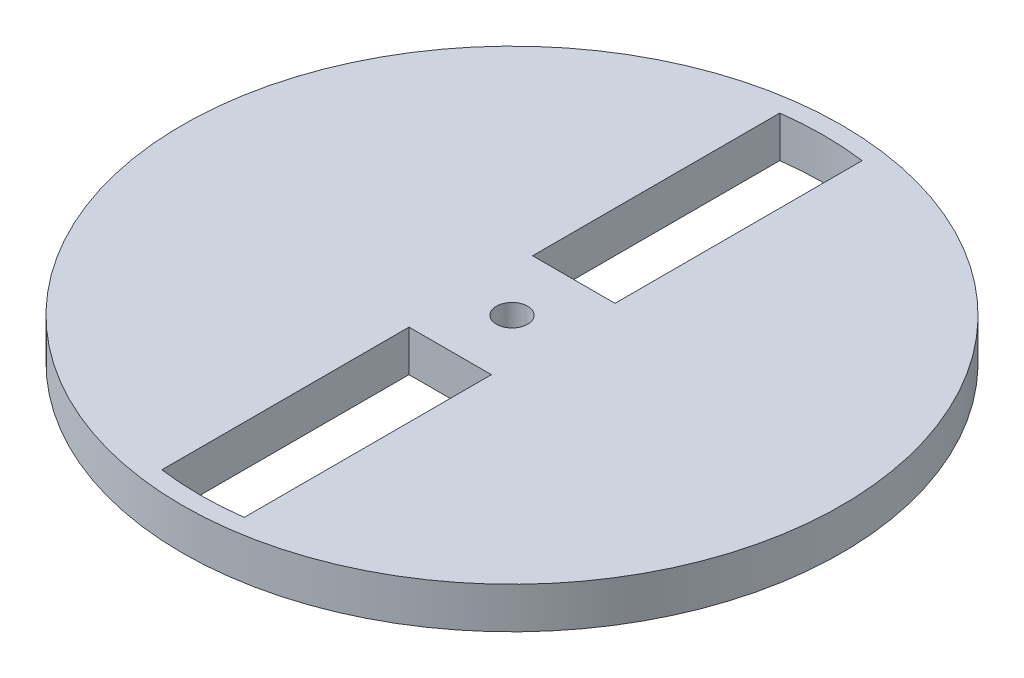
from build123d import *

# Parameters (mm, degrees)
SKETCH1_R           = 20
SKETCH1_R_2         = 0.95
BOSS_EXTRUDE1_DEPTH = 2.5


with BuildPart() as part:
    # Sketch1 → Boss-Extrude1 (new body)
    with BuildSketch(Plane(origin=(0, 0, 0), x_dir=(1, 0, 0), z_dir=(0, 1, 0))):
        with Locations(Location((0, 0, 0), (0, 0, 270))):
            Circle(SKETCH1_R)
        with Locations(Location((0, 0, 0), (0, 0, 270))):
            Circle(SKETCH1_R_2, mode=Mode.SUBTRACT)
        with BuildLine():
            Line((-2.5, 3.75), (2.5, 3.75))
            Line((2.5, 3.75), (2.5, 18.75))
            ThreePointArc((2.5, 18.75), (0, 18.915932438), (-2.5, 18.75))
            Line((-2.5, 18.75), (-2.5, 3.75))
        make_face(mode=Mode.SUBTRACT)
        with BuildLine():
            Line((2.5, -3.75), (2.5, -18.75))
            ThreePointArc((2.5, -18.75), (0, -18.915932438), (-2.5, -18.75))
            Line((-2.5, -18.75), (-2.5, -3.75))
            Line((-2.5, -3.75), (2.5, -3.75))
        make_face(mode=Mode.SUBTRACT)
    extrude(amount=BOSS_EXTRUDE1_DEPTH)


solid = part.part
